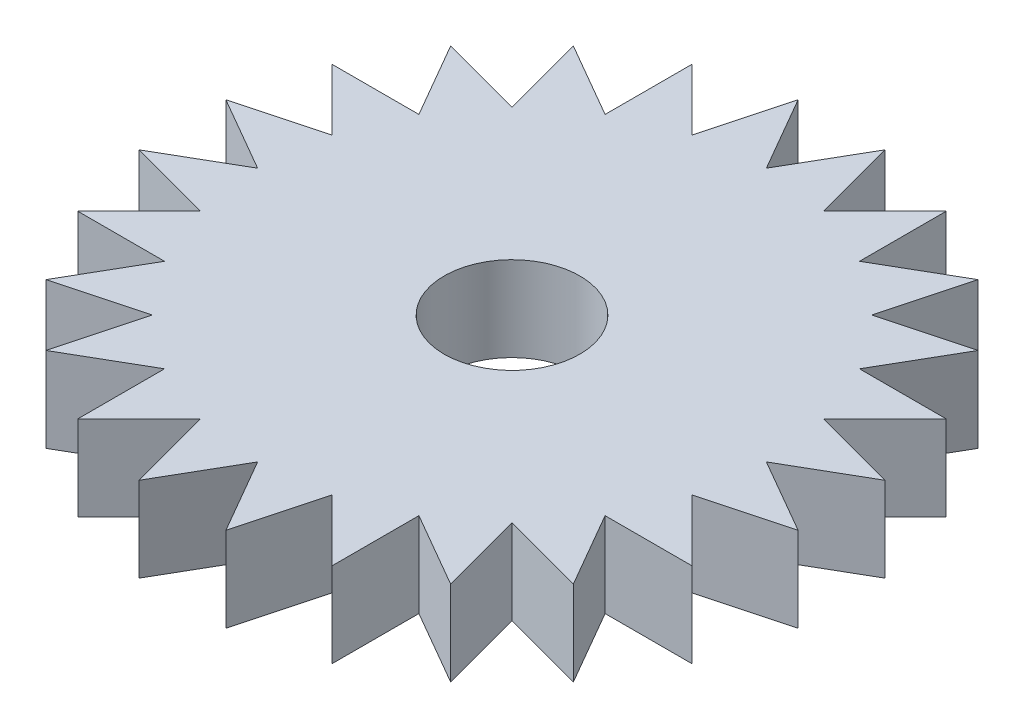
from build123d import *

# Parameters (mm, degrees)
BOSS_EXTRUDE1_DEPTH = 6.35
SKETCH3_R           = 5.08
CUT_EXTRUDE3_DEPTH  = 6.35


with BuildPart() as part:
    # Sketch2 → Boss-Extrude1 (new body)
    with BuildSketch(Plane(origin=(0, 0, 0), x_dir=(1, 0, 0), z_dir=(0, 1, 0))):
        Polygon((-9.525, 16.497783942), (-9.525, 22.995384182), (-4.930502809, 18.400886991), (-3.24880012, 24.677086871), (0, 19.05), (3.24880012, 24.677086871), (4.930502809, 18.400886991), (9.525, 22.995384182), (9.525, 16.497783942), (15.152086871, 19.746584062), (13.470384182, 13.470384182), (19.746584062, 15.152086871), (16.497783942, 9.525), (22.995384182, 9.525), (18.400886991, 4.930502809), (24.677086871, 3.24880012), (19.05, 0), (24.677086871, -3.24880012), (18.400886991, -4.930502809), (22.995384182, -9.525), (16.497783942, -9.525), (19.746584062, -15.152086871), (13.470384182, -13.470384182), (15.152086871, -19.746584062), (9.525, -16.497783942), (9.525, -22.995384182), (4.930502809, -18.400886991), (3.24880012, -24.677086871), (0, -19.05), (-3.24880012, -24.677086871), (-4.930502809, -18.400886991), (-9.525, -22.995384182), (-9.525, -16.497783942), (-15.152086871, -19.746584062), (-13.470384182, -13.470384182), (-19.746584062, -15.152086871), (-16.497783942, -9.525), (-22.995384182, -9.525), (-18.400886991, -4.930502809), (-24.677086871, -3.24880012), (-19.05, 0), (-24.677086871, 3.24880012), (-18.400886991, 4.930502809), (-22.995384182, 9.525), (-16.497783942, 9.525), (-19.746584062, 15.152086871), (-13.470384182, 13.470384182), (-15.152086871, 19.746584062), align=None)
    extrude(amount=BOSS_EXTRUDE1_DEPTH)

    # Sketch3 → Cut-Extrude3 (cut)
    with BuildSketch(Plane(origin=(0, 6.35, 0), x_dir=(1, 0, 0), z_dir=(0, 1, 0))):
        with Locations(Location((0, 0, 0), (0, 0, 270))):
            Circle(SKETCH3_R)
    extrude(amount=-CUT_EXTRUDE3_DEPTH, mode=Mode.SUBTRACT)


solid = part.part
